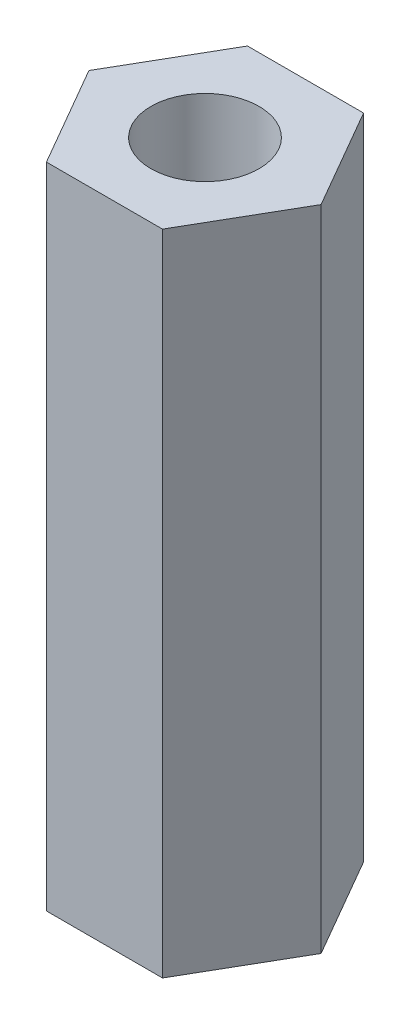
from build123d import *

# Parameters (mm, degrees)
BASE_DEPTH      = 15
HOLE_DEPTH      = 16.41470483
HOLE_DEPTH_BACK = 16.41470483
SKETCH2_R       = 1.25


with BuildPart() as part:
    # Sketch1 → base (new body)
    with BuildSketch(Plane(origin=(0, 0, 0), x_dir=(1, 0, 0), z_dir=(0, 1, 0))):
        Polygon((2.684678752, 0), (1.342339376, 2.325), (-1.342339376, 2.325), (-2.684678752, 0), (-1.342339376, -2.325), (1.342339376, -2.325), align=None)
    extrude(amount=BASE_DEPTH)

    # Sketch2 → hole (cut, two sides: drawn at the far end of the back side and taken through both)
    with BuildSketch(Plane(origin=(0, 15, 0), x_dir=(1, 0, 0), z_dir=(0, 1, 0)).offset(-HOLE_DEPTH_BACK)):
        with Locations(Location((0, 0, 0), (0, 0, 270))):
            Circle(SKETCH2_R)
    extrude(amount=HOLE_DEPTH + HOLE_DEPTH_BACK, mode=Mode.SUBTRACT)


solid = part.part
